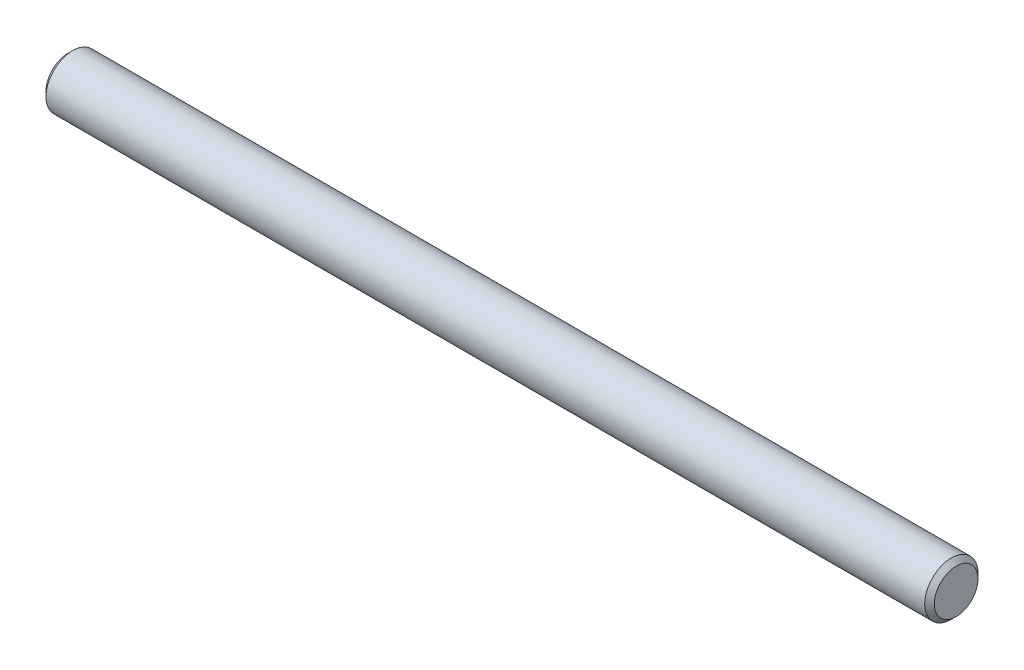
from build123d import *


with BuildPart() as part:
    # Sketch1 → Revolve1 (revolve)
    with BuildSketch(Plane.XY, mode=Mode.PRIVATE) as revolve1_sk:
        Polygon((0, 0), (0, 2.46), (0.54, 3), (99.46, 3), (100, 2.46), (100, 0), align=None)
    revolve(revolve1_sk.sketch.rotate(Axis((0, 0, 0), (1, 0, 0)), 90), axis=Axis((0, 0, 0), (1, 0, 0)))


solid = part.part
